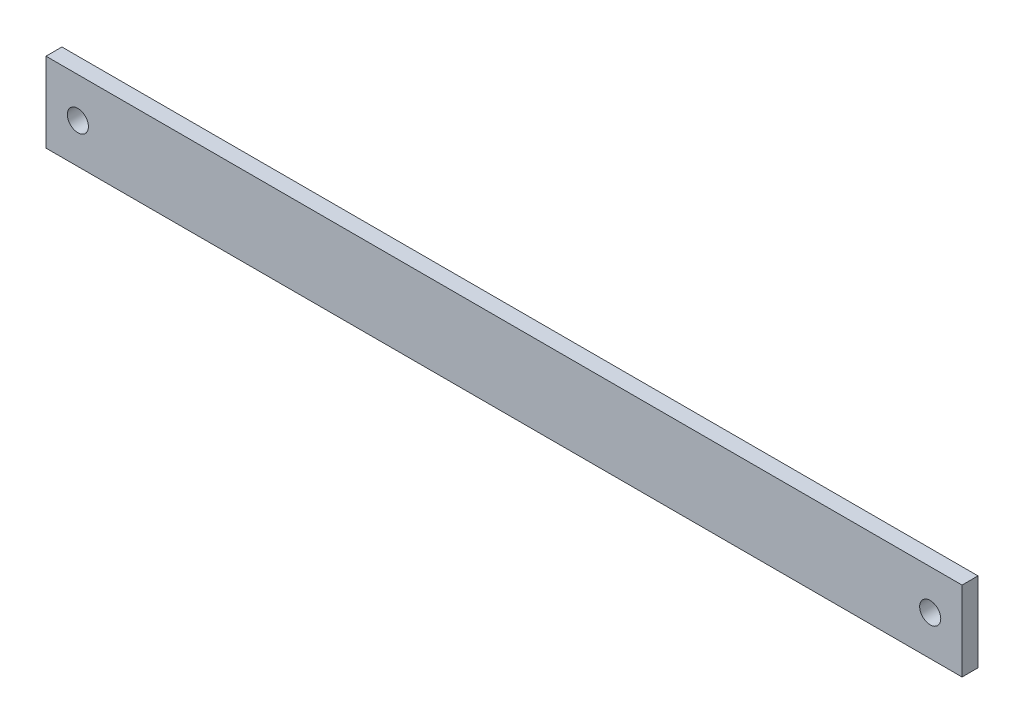
from build123d import *

# Parameters (mm, degrees)
EXTRUSION_BASE_SKETCH_W      = 230
EXTRUSION_BASE_SKETCH_H      = 20
EXTRUSION_BASE_SKETCH_R      = 2.65
EXTRUSION_BASE_EXTRUDE_DEPTH = 4


with BuildPart() as part:
    # Extrusion Base Sketch → Extrusion Base Extrude (new body)
    with BuildSketch(Plane.XY):
        with Locations((115, 10)):
            Rectangle(EXTRUSION_BASE_SKETCH_W, EXTRUSION_BASE_SKETCH_H)
        with Locations((8, 10)):
            Circle(EXTRUSION_BASE_SKETCH_R, mode=Mode.SUBTRACT)
        with Locations((222, 10)):
            Circle(EXTRUSION_BASE_SKETCH_R, mode=Mode.SUBTRACT)
    extrude(amount=-EXTRUSION_BASE_EXTRUDE_DEPTH)


solid = part.part
